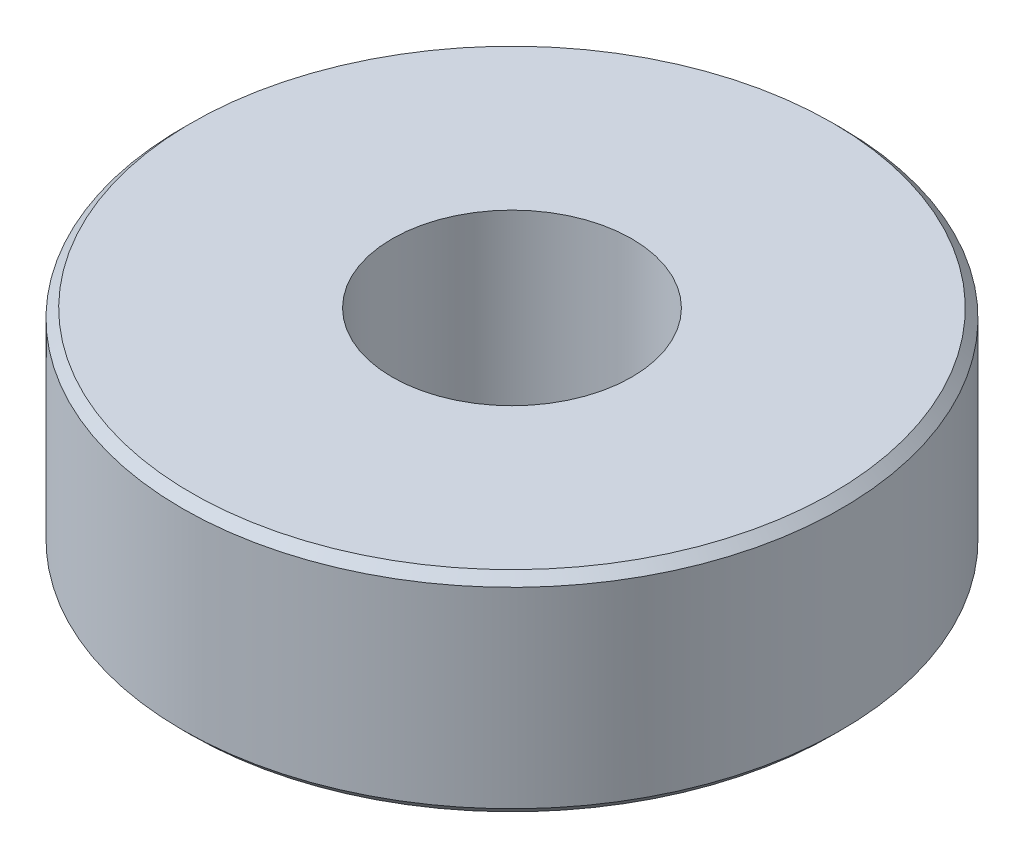
from build123d import *

# Parameters (mm, degrees)
BOSS_EXTRUDE1_DEPTH      = 3.5
BOSS_EXTRUDE1_DEPTH_BACK = 3.5
SKETCH1_R                = 11
SKETCH1_R_2              = 4
CHAMFER1_SIZE            = 0.3


with BuildPart() as part:
    # Sketch1 → Boss-Extrude1 (new, two sides: drawn at the far end of the back side and taken through both)
    with BuildSketch(Plane(origin=(0, 0, 0), x_dir=(1, 0, 0), z_dir=(0, 1, 0)).offset(-BOSS_EXTRUDE1_DEPTH_BACK)):
        Circle(SKETCH1_R)
        Circle(SKETCH1_R_2, mode=Mode.SUBTRACT)
    extrude(amount=BOSS_EXTRUDE1_DEPTH + BOSS_EXTRUDE1_DEPTH_BACK)

    # Chamfer1
    chamfer1_edges = [part.edges().sort_by_distance(p)[0] for p in [
        (-11, -3.5, 0),
        (-11, 3.5, 0),
    ]]
    chamfer(chamfer1_edges, length=CHAMFER1_SIZE)


solid = part.part
